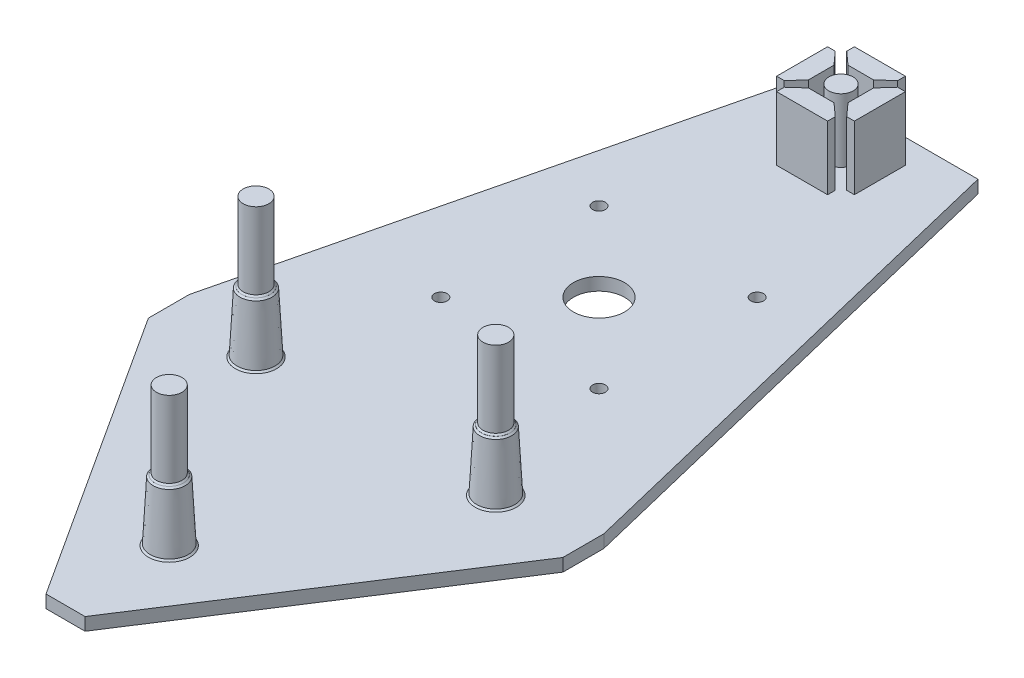
from build123d import *
from OCP.BRepFilletAPI import BRepFilletAPI_MakeChamfer

# Parameters (mm, degrees)
SKETCH1_W               = 82.55
SKETCH1_H               = 164.338
SKETCH1_R               = 5.08
SKETCH1_R_2             = 1.27
BASE_EXTRUDE_DEPTH      = 2.54
SKETCH6_R               = 2.413
MIDDLE_BAR_HOLDER_DEPTH = 12.7
SKETCH7_R               = 2.55
BOSS_EXTRUDE6_DEPTH     = 27.686
SKETCH7_3_R             = 3.81
SKETCH7_3_R_2           = 2.55
BOSS_EXTRUDE7_DEPTH     = 12.192
CUT_EXTRUDE1_DEPTH      = 10
DRAFT4_ANGLE            = 4
DRAFT5_ANGLE            = 3
CHAMFER1_SIZE           = 0.3
CHAMFER1_SIZE2          = 0.317026351
CHAMFER2_SIZE           = 0.3
CHAMFER2_SIZE2          = 0.317026351
CHAMFER3_SIZE           = 0.3
CHAMFER3_SIZE2          = 0.317026351


with BuildPart() as part:
    # Sketch1 → base extrude (new body)
    with BuildSketch(Plane(origin=(0, 0, 0), x_dir=(1, 0, 0), z_dir=(0, 1, 0))):
        with Locations((41.275, -82.169)):
            Rectangle(SKETCH1_W, SKETCH1_H)
        with Locations(Location((41.275, -58.1000108, 0), (0, 0, 270))):
            Circle(SKETCH1_R, mode=Mode.SUBTRACT)
        with Locations(Location((57.023, -42.3520108, 0), (0, 0, 270))):
            Circle(SKETCH1_R_2, mode=Mode.SUBTRACT)
        with Locations(Location((57.023, -73.8480108, 0), (0, 0, 270))):
            Circle(SKETCH1_R_2, mode=Mode.SUBTRACT)
        with Locations(Location((25.527, -73.8480108, 0), (0, 0, 270))):
            Circle(SKETCH1_R_2, mode=Mode.SUBTRACT)
        with Locations(Location((25.527, -42.3520108, 0), (0, 0, 270))):
            Circle(SKETCH1_R_2, mode=Mode.SUBTRACT)
    extrude(amount=BASE_EXTRUDE_DEPTH)

    # Sketch6 → middle bar holder (add)
    with BuildSketch(Plane(origin=(0, 2.54, 0), x_dir=(1, 0, 0), z_dir=(0, 1, 0))):
        Polygon((33.528, -9.906), (33.528, -4.826), (35.052, -4.826), (37.338, -7.366), (37.338, -9.906), (37.338, -12.446), (35.052, -14.986), (33.528, -14.986), align=None)
        with Locations(Location((41.275, -9.906, 0), (0, 0, 270))):
            Circle(SKETCH6_R)
        Polygon((41.275, -2.159), (46.355, -2.159), (46.355, -3.683), (43.815, -5.969), (41.275, -5.969), (38.735, -5.969), (36.195, -3.683), (36.195, -2.159), align=None)
        Polygon((47.498, -14.986), (45.212, -12.446), (45.212, -9.906), (45.212, -7.366), (47.498, -4.826), (49.022, -4.826), (49.022, -9.906), (49.022, -14.986), align=None)
        Polygon((41.275, -17.653), (36.195, -17.653), (36.195, -16.129), (38.735, -13.843), (41.275, -13.843), (43.815, -13.843), (46.355, -16.129), (46.355, -17.653), align=None)
    extrude(amount=MIDDLE_BAR_HOLDER_DEPTH)

    # Sketch7 → Boss-Extrude6 (add)
    with BuildSketch(Plane(origin=(0, 2.54, 0), x_dir=(1, 0, 0), z_dir=(0, 1, 0))):
        with Locations(Location((17.399, -102.529, 0), (0, 0, 270))):
            Circle(SKETCH7_R)
        with Locations(Location((41.275, -143.692, 0), (0, 0, 270))):
            Circle(SKETCH7_R)
        with Locations(Location((65.151, -102.529, 0), (0, 0, 270))):
            Circle(SKETCH7_R)
    extrude(amount=BOSS_EXTRUDE6_DEPTH)

    # Sketch7<3> → Boss-Extrude7 (add)
    # profile 1 of 3: a face of its own
    with BuildSketch(Plane(origin=(0, 2.54, 0), x_dir=(1, 0, 0), z_dir=(0, 1, 0))):
        with Locations(Location((41.275, -143.692, 0), (0, 0, 90))):
            Circle(SKETCH7_3_R)
        with Locations(Location((41.275, -143.692, 0), (0, 0, 270))):
            Circle(SKETCH7_3_R_2, mode=Mode.SUBTRACT)
    # profile 2 of 3: a face of its own
    with BuildSketch(Plane(origin=(0, 2.54, 0), x_dir=(1, 0, 0), z_dir=(0, 1, 0))):
        with Locations(Location((65.151, -102.529, 0), (0, 0, 90))):
            Circle(SKETCH7_3_R)
        with Locations(Location((65.151, -102.529, 0), (0, 0, 270))):
            Circle(SKETCH7_3_R_2, mode=Mode.SUBTRACT)
    # profile 3 of 3: a face of its own
    with BuildSketch(Plane(origin=(0, 2.54, 0), x_dir=(1, 0, 0), z_dir=(0, 1, 0))):
        with Locations(Location((17.399, -102.529, 0), (0, 0, 90))):
            Circle(SKETCH7_3_R)
        with Locations(Location((17.399, -102.529, 0), (0, 0, 270))):
            Circle(SKETCH7_3_R_2, mode=Mode.SUBTRACT)
    extrude(amount=BOSS_EXTRUDE7_DEPTH)

    # Sketch8 → Cut-Extrude1 (cut)
    with BuildSketch(Plane(origin=(0, 2.54, 0), x_dir=(1, 0, 0), z_dir=(0, 1, 0))):
        Polygon((0, -164.338), (37.384522851, -164.338), (0, -106.566701997), align=None)
        Polygon((82.55, -106.566701997), (45.165477149, -164.338), (82.55, -164.338), align=None)
        Polygon((58.654991564, 0), (82.55, -98.406378462), (82.55, 0), align=None)
        Polygon((0, 0), (0, -98.406378462), (23.895008436, 0), align=None)
    extrude(amount=-CUT_EXTRUDE1_DEPTH, mode=Mode.SUBTRACT)

    # Draft4
    draft4_faces = [part.faces().sort_by_distance(p)[0] for p in [
        (41.275, 8.636, 147.502),
        (17.399, 8.636, 106.339),
        (65.151, 8.636, 106.339),
    ]]
    draft(draft4_faces, Plane.ZX.offset(2.54), DRAFT4_ANGLE)

    # Draft5
    draft5_faces = [part.faces().sort_by_distance(p)[0] for p in [
        (41.275, 8.636, 147.075726154),
        (65.151, 8.636, 105.912726154),
        (17.399, 8.636, 105.912726154),
    ]]
    draft(draft5_faces, Plane.ZX.offset(2.54), DRAFT5_ANGLE)

    # Chamfer1: one chamfer whose edges measure the first distance from different faces: ONE call of the kernel's chamfer builder (chamfer() names one face for all edges)
    chamfer1_edges_1 = [part.edges().sort_by_distance(p)[0] for p in [
        (65.151, 14.732, 99.979),
    ]]
    chamfer1_edges_2 = [part.edges().sort_by_distance(p)[0] for p in [
        (65.151, 2.54, 106.339),
    ]]
    chamfer1_side_2 = [part.faces().sort_by_distance(p)[0] for p in [
        (65.151, 8.636, 106.019522177),
    ]]
    chamfer1_edges_3 = [part.edges().sort_by_distance(p)[0] for p in [
        (65.151, 14.732, 105.700044355),
    ]]
    chamfer1_side_3 = [part.faces().sort_by_distance(p)[0] for p in [
        (65.151, 14.732, 105.610353676),
    ]]
    chamfer1 = BRepFilletAPI_MakeChamfer(part.part.solid().wrapped)
    for e in chamfer1_edges_1:
        chamfer1.Add(CHAMFER1_SIZE, e.wrapped)
    for e in chamfer1_edges_2:
        chamfer1.Add(CHAMFER1_SIZE, CHAMFER1_SIZE2, e.wrapped, chamfer1_side_2[0].wrapped)  # the first distance lies on this face
    for e in chamfer1_edges_3:
        chamfer1.Add(CHAMFER1_SIZE, CHAMFER1_SIZE2, e.wrapped, chamfer1_side_3[0].wrapped)  # the first distance lies on this face
    add(Compound.cast(chamfer1.Shape()), mode=Mode.REPLACE)

    # Chamfer2: one chamfer whose edges measure the first distance from different faces: ONE call of the kernel's chamfer builder (chamfer() names one face for all edges)
    chamfer2_edges_1 = [part.edges().sort_by_distance(p)[0] for p in [
        (17.399, 14.732, 99.979),
    ]]
    chamfer2_edges_2 = [part.edges().sort_by_distance(p)[0] for p in [
        (17.399, 2.54, 106.339),
    ]]
    chamfer2_side_2 = [part.faces().sort_by_distance(p)[0] for p in [
        (41.253202906, 2.54, 80.858952194),
    ]]
    chamfer2_edges_3 = [part.edges().sort_by_distance(p)[0] for p in [
        (17.399, 14.732, 105.700044355),
    ]]
    chamfer2_side_3 = [part.faces().sort_by_distance(p)[0] for p in [
        (17.399, 8.636, 106.019522177),
    ]]
    chamfer2 = BRepFilletAPI_MakeChamfer(part.part.solid().wrapped)
    for e in chamfer2_edges_1:
        chamfer2.Add(CHAMFER2_SIZE, e.wrapped)
    for e in chamfer2_edges_2:
        chamfer2.Add(CHAMFER2_SIZE, CHAMFER2_SIZE2, e.wrapped, chamfer2_side_2[0].wrapped)  # the first distance lies on this face
    for e in chamfer2_edges_3:
        chamfer2.Add(CHAMFER2_SIZE, CHAMFER2_SIZE2, e.wrapped, chamfer2_side_3[0].wrapped)  # the first distance lies on this face
    add(Compound.cast(chamfer2.Shape()), mode=Mode.REPLACE)

    # Chamfer3: one chamfer whose edges measure the first distance from different faces: ONE call of the kernel's chamfer builder (chamfer() names one face for all edges)
    chamfer3_edges_1 = [part.edges().sort_by_distance(p)[0] for p in [
        (41.275, 14.732, 141.142),
    ]]
    chamfer3_edges_2 = [part.edges().sort_by_distance(p)[0] for p in [
        (41.275, 2.54, 147.502),
    ]]
    chamfer3_side_2 = [part.faces().sort_by_distance(p)[0] for p in [
        (41.27378406, 2.54, 80.840255506),
    ]]
    chamfer3_edges_3 = [part.edges().sort_by_distance(p)[0] for p in [
        (41.275, 14.732, 146.863044355),
    ]]
    chamfer3_side_3 = [part.faces().sort_by_distance(p)[0] for p in [
        (41.275, 8.636, 147.182522177),
    ]]
    chamfer3 = BRepFilletAPI_MakeChamfer(part.part.solid().wrapped)
    for e in chamfer3_edges_1:
        chamfer3.Add(CHAMFER3_SIZE, e.wrapped)
    for e in chamfer3_edges_2:
        chamfer3.Add(CHAMFER3_SIZE, CHAMFER3_SIZE2, e.wrapped, chamfer3_side_2[0].wrapped)  # the first distance lies on this face
    for e in chamfer3_edges_3:
        chamfer3.Add(CHAMFER3_SIZE, CHAMFER3_SIZE2, e.wrapped, chamfer3_side_3[0].wrapped)  # the first distance lies on this face
    add(Compound.cast(chamfer3.Shape()), mode=Mode.REPLACE)


solid = part.part
